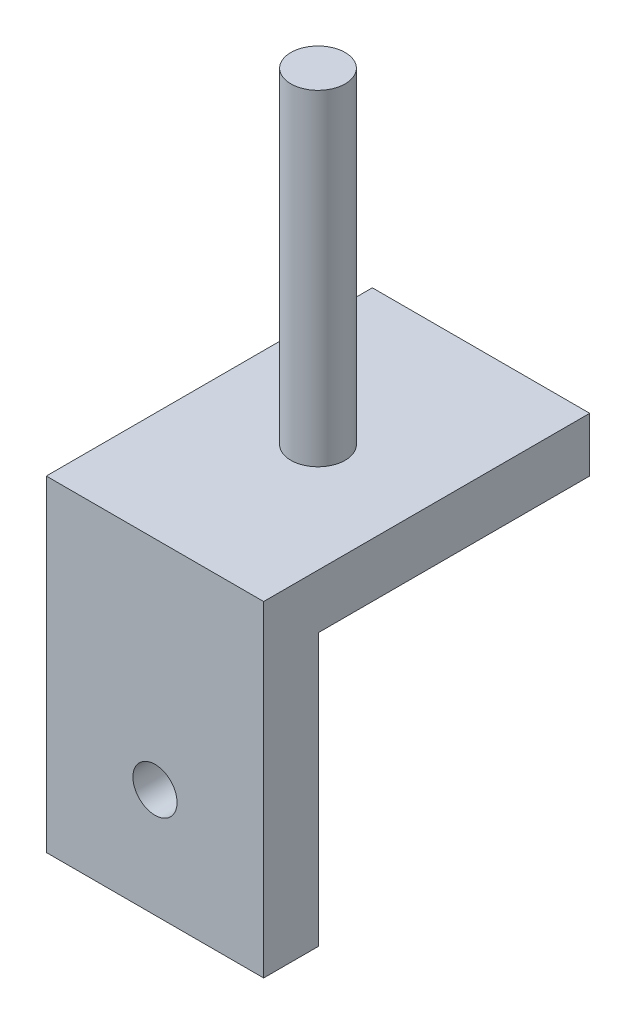
from build123d import *

# Parameters (mm, degrees)
SKETCH1_W                                  = 50.8
SKETCH1_H                                  = 76.2
BOSS_EXTRUDE1_DEPTH                        = 12.7
SKETCH2_R                                  = 6.35
BOSS_EXTRUDE2_DEPTH                        = 76.2
SKETCH4_W                                  = 50.8
SKETCH4_H                                  = 12.808038323
BOSS_EXTRUDE3_DEPTH                        = 76.2
F_13_32_0_40625_DIAMETER_HOLE1_D           = 10.31875
F_13_32_0_40625_DIAMETER_HOLE1_CSINK_D     = 11.58875
F_13_32_0_40625_DIAMETER_HOLE1_CSINK_ANGLE = 90


with BuildPart() as part:
    # Sketch1 → Boss-Extrude1 (new body)
    with BuildSketch(Plane(origin=(0, 0, 0), x_dir=(1, 0, 0), z_dir=(0, 1, 0))):
        Rectangle(SKETCH1_W, SKETCH1_H)
    extrude(amount=BOSS_EXTRUDE1_DEPTH)

    # Sketch2 → Boss-Extrude2 (add)
    with BuildSketch(Plane(origin=(0, 12.7, 0), x_dir=(1, 0, 0), z_dir=(0, 1, 0))):
        with Locations(Location((0, 0, 0), (0, 0, 90))):
            Circle(SKETCH2_R)
    extrude(amount=BOSS_EXTRUDE2_DEPTH)

    # Sketch4 → Boss-Extrude3 (add)
    with BuildSketch(Plane(origin=(0, 12.7, 0), x_dir=(1, 0, 0), z_dir=(0, 1, 0))):
        with Locations((0, -31.695980839)):
            Rectangle(SKETCH4_W, SKETCH4_H)
    extrude(amount=-BOSS_EXTRUDE3_DEPTH)

    # 13/32 (0.40625) Diameter Hole1 (through all)
    with Locations(Plane(origin=(0, 0, 25.291961677), x_dir=(-1, 0, 0), z_dir=(0, 0, -1))):
        with Locations((0, -38.1)):
            CounterSinkHole(F_13_32_0_40625_DIAMETER_HOLE1_D / 2, F_13_32_0_40625_DIAMETER_HOLE1_CSINK_D / 2, counter_sink_angle=F_13_32_0_40625_DIAMETER_HOLE1_CSINK_ANGLE)


solid = part.part
